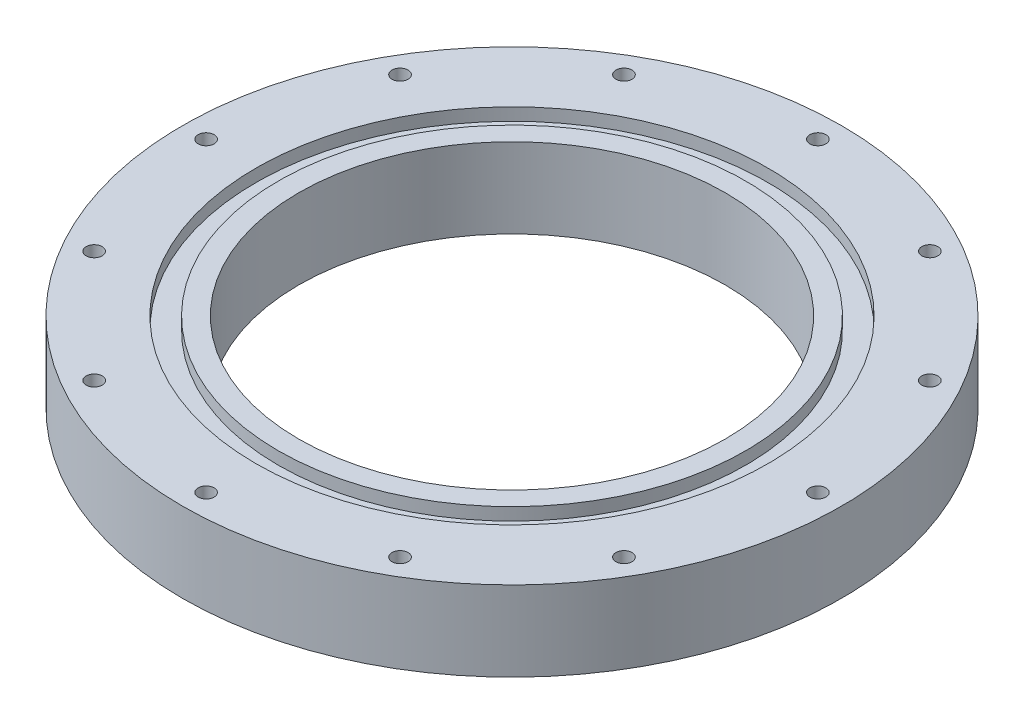
from build123d import *

# Parameters (mm, degrees)
SKETCH2_R         = 104.775
SKETCH2_R_2       = 67.818
FLANGE_DEPTH      = 25.4
SKETCH4_R         = 81.407
SKETCH4_R_2       = 74.295
GROOVE_DEPTH      = 3.9878
SKETCH5_R         = 2.5527
SCREW_HOLES_DEPTH = 25.4
CIRPATTERN1_COUNT = 12


with BuildPart() as part:
    # Sketch2 → Flange (new body)
    with BuildSketch(Plane(origin=(0, 0, 0), x_dir=(1, 0, 0), z_dir=(0, 1, 0))):
        with Locations(Location((0, 0, 0), (0, 0, 270))):
            Circle(SKETCH2_R)
        with Locations(Location((0, 0, 0), (0, 0, 270))):
            Circle(SKETCH2_R_2, mode=Mode.SUBTRACT)
    extrude(amount=FLANGE_DEPTH)

    # Sketch4 → Groove (cut)
    with BuildSketch(Plane(origin=(0, 25.4, 0), x_dir=(1, 0, 0), z_dir=(0, 1, 0))):
        with Locations(Location((0, 0, 0), (0, 0, 270))):
            Circle(SKETCH4_R)
        with Locations(Location((0, 0, 0), (0, 0, 270))):
            Circle(SKETCH4_R_2, mode=Mode.SUBTRACT)
    extrude(amount=-GROOVE_DEPTH, mode=Mode.SUBTRACT)

    # Sketch5 → Screw Holes (cut)
    with BuildSketch(Plane(origin=(0, 25.4, 0), x_dir=(1, 0, 0), z_dir=(0, 1, 0))):
        with Locations(Location((0, -97.25025, 0), (0, 0, 270))):
            Circle(SKETCH5_R)
    screw_holes = extrude(amount=-SCREW_HOLES_DEPTH, mode=Mode.SUBTRACT)

    # CirPattern1: Screw Holes ×12 about axis
    cirpattern1_axis = Axis((0, 0, 0), (0, 1, 0))
    for i in range(1, CIRPATTERN1_COUNT):
        add(screw_holes.rotate(cirpattern1_axis, i * 360 / CIRPATTERN1_COUNT), mode=Mode.SUBTRACT)


solid = part.part
